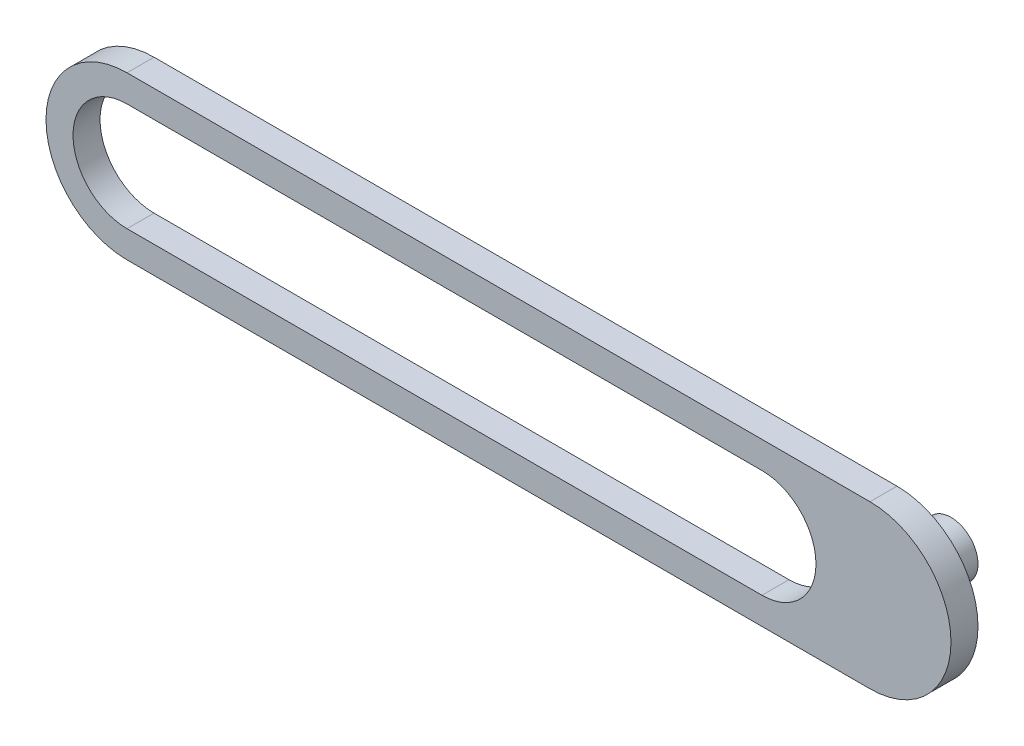
from build123d import *

# Parameters (mm, degrees)
SKETCH1_R           = 5
BOSS_EXTRUDE1_DEPTH = 5
SKETCH1_3_R         = 5
BOSS_EXTRUDE2_DEPTH = 10


with BuildPart() as part:
    # Sketch1 → Boss-Extrude1 (new body)
    # profile 1 of 2: a face of its own
    with BuildSketch(Plane.XY):
        with BuildLine():
            Line((-66.903225806, -15), (70.64516129, -15))
            ThreePointArc((70.64516129, -15), (85.64516129, 0), (70.64516129, 15))
            Line((70.64516129, 15), (-66.903225806, 15))
            ThreePointArc((-66.903225806, 15), (-73.026950163, 13.693063938), (-78.083565694, 10))
            ThreePointArc((-78.083565694, 10), (-81.903225806, 0), (-78.083565694, -10))
            ThreePointArc((-78.083565694, -10), (-73.026950163, -13.693063938), (-66.903225806, -15))
        make_face()
        with BuildLine():
            Line((50.64516129, -10), (-66.903225806, -10))
            ThreePointArc((-66.903225806, -10), (-76.903225806, 0), (-66.903225806, 10))
            Line((-66.903225806, 10), (50.64516129, 10))
            ThreePointArc((50.64516129, 10), (60.64516129, 0), (50.64516129, -10))
        make_face(mode=Mode.SUBTRACT)
        with Locations((70.64516129, 0)):
            Circle(SKETCH1_R, mode=Mode.SUBTRACT)
    # profile 2 of 2: a face of its own
    with BuildSketch(Plane.XY):
        with Locations((70.64516129, 0)):
            Circle(SKETCH1_R)
    extrude(amount=BOSS_EXTRUDE1_DEPTH)

    # Sketch1<3> → Boss-Extrude2 (add)
    with BuildSketch(Plane.XY):
        with Locations((70.64516129, 0)):
            Circle(SKETCH1_3_R)
    extrude(amount=-BOSS_EXTRUDE2_DEPTH)


solid = part.part
